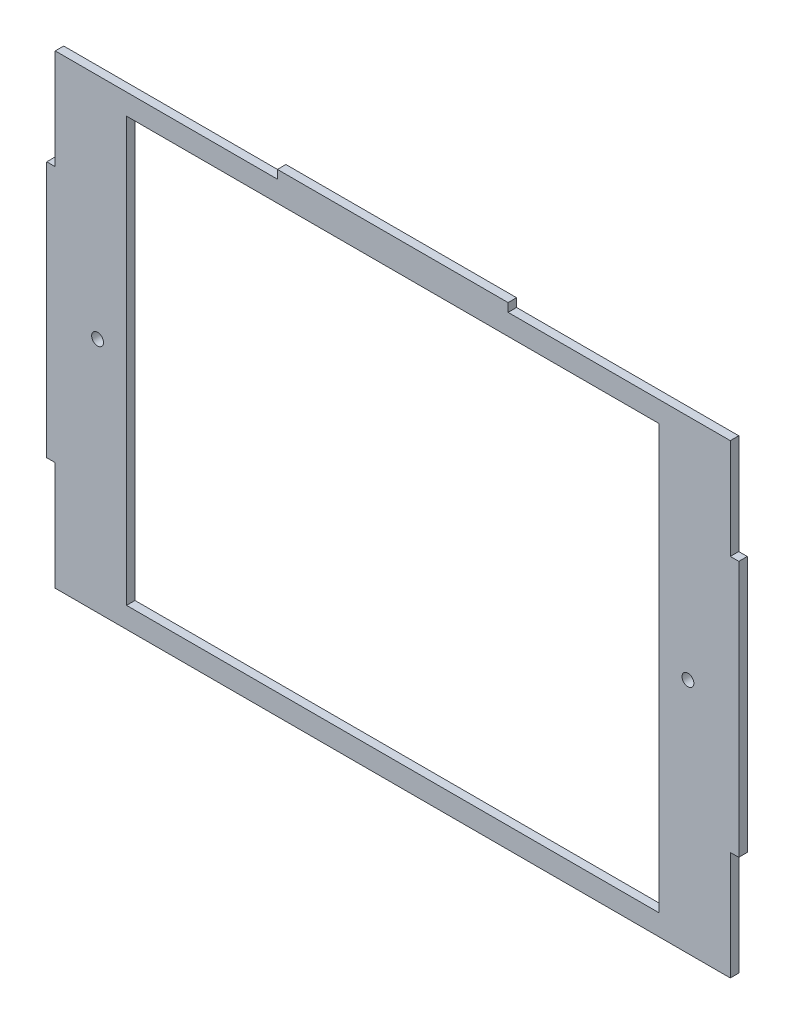
from build123d import *

# Parameters (mm, degrees)
SKETCH1_W            = 490
SKETCH1_H            = 335.5
BOSS_EXTRUDE1_DEPTH  = 6
SKETCH5_W            = 6
SKETCH5_H            = 77
CUT_EXTRUDE2_DEPTH   = 594.882353669
SKETCH3_W            = 377
SKETCH3_H            = 300
CUT_EXTRUDE3_DEPTH   = 594.882353669
SKETCH6_W            = 157.333333333
SKETCH6_H            = 6
CUT_EXTRUDE4_DEPTH   = 594.882353669
M8_CLEARANCE_SLOT1_D = 8.4


with BuildPart() as part:
    # Sketch1 → Boss-Extrude1 (new body)
    with BuildSketch(Plane.XY):
        with Locations((245, 167.75)):
            Rectangle(SKETCH1_W, SKETCH1_H)
    extrude(amount=BOSS_EXTRUDE1_DEPTH)

    # Sketch5 → Cut-Extrude2 (cut, through all)
    with BuildSketch(Plane.XY.offset(6)):
        with Locations((3, 297)):
            Rectangle(SKETCH5_W, SKETCH5_H)
        with Locations((3, 38.5)):
            Rectangle(SKETCH5_W, SKETCH5_H)
        with Locations((487, 297)):
            Rectangle(SKETCH5_W, SKETCH5_H)
        with Locations((487, 38.5)):
            Rectangle(SKETCH5_W, SKETCH5_H)
    extrude(amount=-CUT_EXTRUDE2_DEPTH, mode=Mode.SUBTRACT)

    # Sketch3 → Cut-Extrude3 (cut, through all)
    with BuildSketch(Plane.XY.offset(6)):
        with Locations((245, 164.75)):
            Rectangle(SKETCH3_W, SKETCH3_H)
    extrude(amount=-CUT_EXTRUDE3_DEPTH, mode=Mode.SUBTRACT)

    # Sketch6 → Cut-Extrude4 (cut, through all)
    with BuildSketch(Plane.XY.offset(6)):
        with Locations((405.333333334, 332.5)):
            Rectangle(SKETCH6_W, SKETCH6_H)
        with Locations((84.666666667, 332.5)):
            Rectangle(SKETCH6_W, SKETCH6_H)
    extrude(amount=-CUT_EXTRUDE4_DEPTH, mode=Mode.SUBTRACT)

    # M8 Clearance Slot1 (through all)
    with Locations(Plane.XY.offset(6)):
        with Locations((36, 167.75), (454, 167.75)):
            Hole(M8_CLEARANCE_SLOT1_D / 2)


solid = part.part
